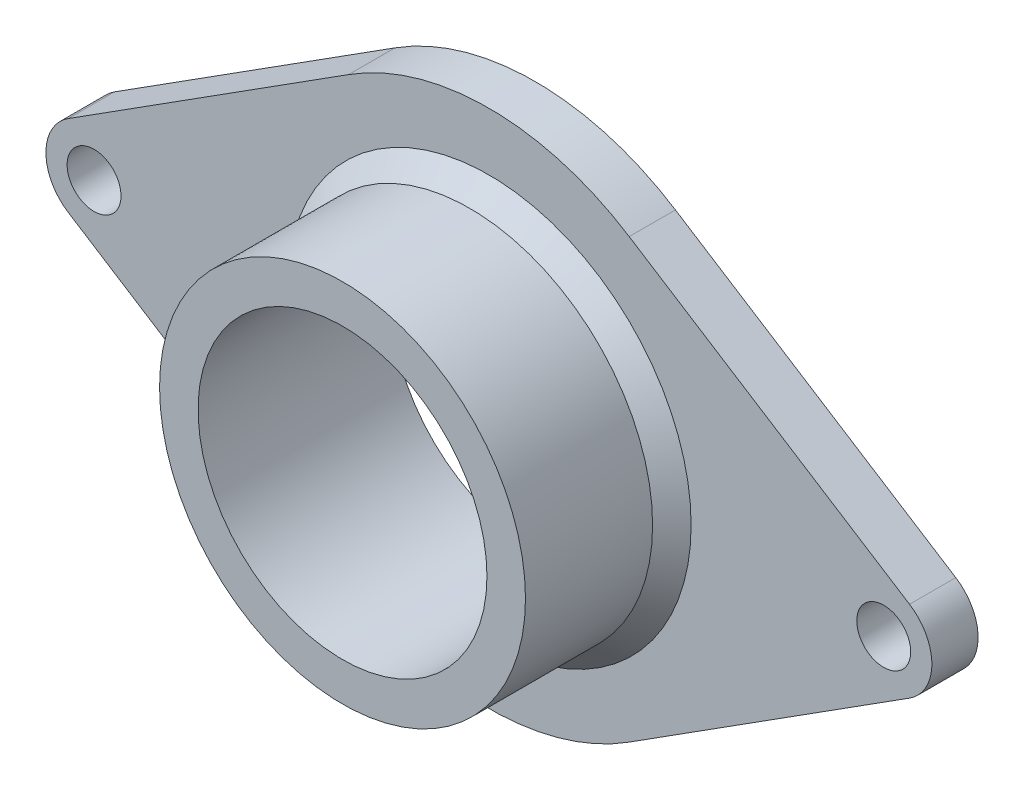
from build123d import *

# Parameters (mm, degrees)
SKETCH1_R               = 47.5
SKETCH1_R_2             = 37.5
BOSS_EXTRUDE1_DEPTH     = 50
SKETCH2_R               = 47.5
BOSS_EXTRUDE2_DEPTH     = 12
CUT_EXTRUDE1_DEPTH      = 143.412253686
CUT_EXTRUDE1_DEPTH_BACK = 143.412253686
SKETCH3_R               = 7
CHAMFER1_SIZE           = 5


with BuildPart() as part:
    # Sketch1 → Boss-Extrude1 (new body)
    with BuildSketch(Plane.XY):
        Circle(SKETCH1_R)
        Circle(SKETCH1_R_2, mode=Mode.SUBTRACT)
    extrude(amount=BOSS_EXTRUDE1_DEPTH)

    # Sketch2 → Boss-Extrude2 (add)
    with BuildSketch(Plane(origin=(0, 0, 0), x_dir=(-1, 0, 0), z_dir=(0, 0, -1))):
        with BuildLine():
            Line((36.425087952, -56.828364112), (109.207263185, -10.54810981))
            ThreePointArc((109.207263185, -10.54810981), (115, 0), (109.207263185, 10.54810981))
            Line((109.207263185, 10.54810981), (36.425087952, 56.828364112))
            ThreePointArc((36.425087952, 56.828364112), (0, 67.5), (-36.425087952, 56.828364112))
            Line((-36.425087952, 56.828364112), (-109.207263185, 10.54810981))
            ThreePointArc((-109.207263185, 10.54810981), (-115, 0), (-109.207263185, -10.54810981))
            Line((-109.207263185, -10.54810981), (-36.425087952, -56.828364112))
            ThreePointArc((-36.425087952, -56.828364112), (0, -67.5), (36.425087952, -56.828364112))
        make_face()
        Circle(SKETCH2_R, mode=Mode.SUBTRACT)
    extrude(amount=-BOSS_EXTRUDE2_DEPTH)

    # Sketch3 → Cut-Extrude1 (cut, two sides: drawn at the far end of the back side and taken through both)
    with BuildSketch(Plane(origin=(0, 0, 0), x_dir=(-1, 0, 0), z_dir=(0, 0, -1)).offset(-CUT_EXTRUDE1_DEPTH_BACK)):
        with Locations((102.5, 0)):
            Circle(SKETCH3_R)
        with Locations((-102.5, 0)):
            Circle(SKETCH3_R)
    extrude(amount=CUT_EXTRUDE1_DEPTH + CUT_EXTRUDE1_DEPTH_BACK, mode=Mode.SUBTRACT)

    # Chamfer1
    chamfer1_edges = [part.edges().sort_by_distance(p)[0] for p in [
        (-47.5, 0, 12),
    ]]
    chamfer(chamfer1_edges, length=CHAMFER1_SIZE)


solid = part.part
